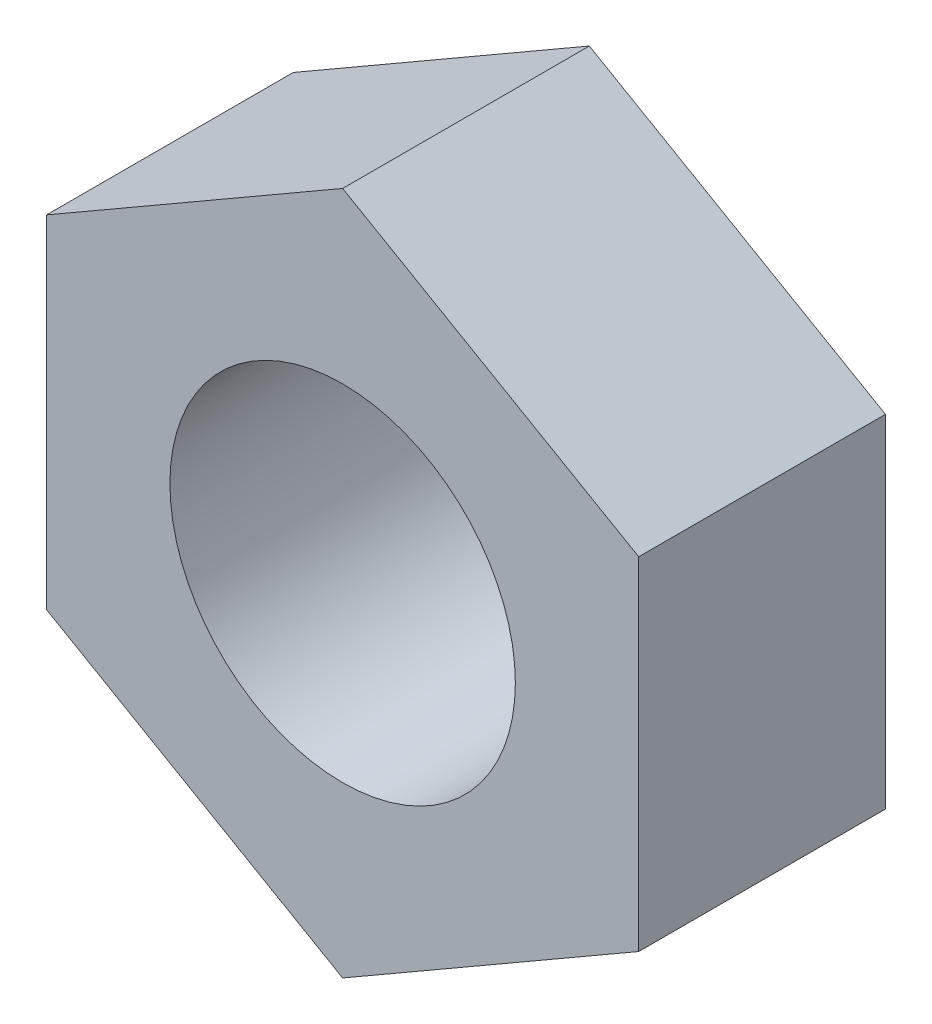
from build123d import *

# Parameters (mm, degrees)
SKETCH1_R           = 7
BOSS_EXTRUDE1_DEPTH = 5


with BuildPart() as part:
    # Sketch1 → Boss-Extrude1 (new, symmetric)
    with BuildSketch(Plane.XY):
        Polygon((0, 13.856406461), (-12, 6.92820323), (-12, -6.92820323), (0, -13.856406461), (12, -6.92820323), (12, 6.92820323), align=None)
        Circle(SKETCH1_R, mode=Mode.SUBTRACT)
    extrude(amount=BOSS_EXTRUDE1_DEPTH, both=True)


solid = part.part
